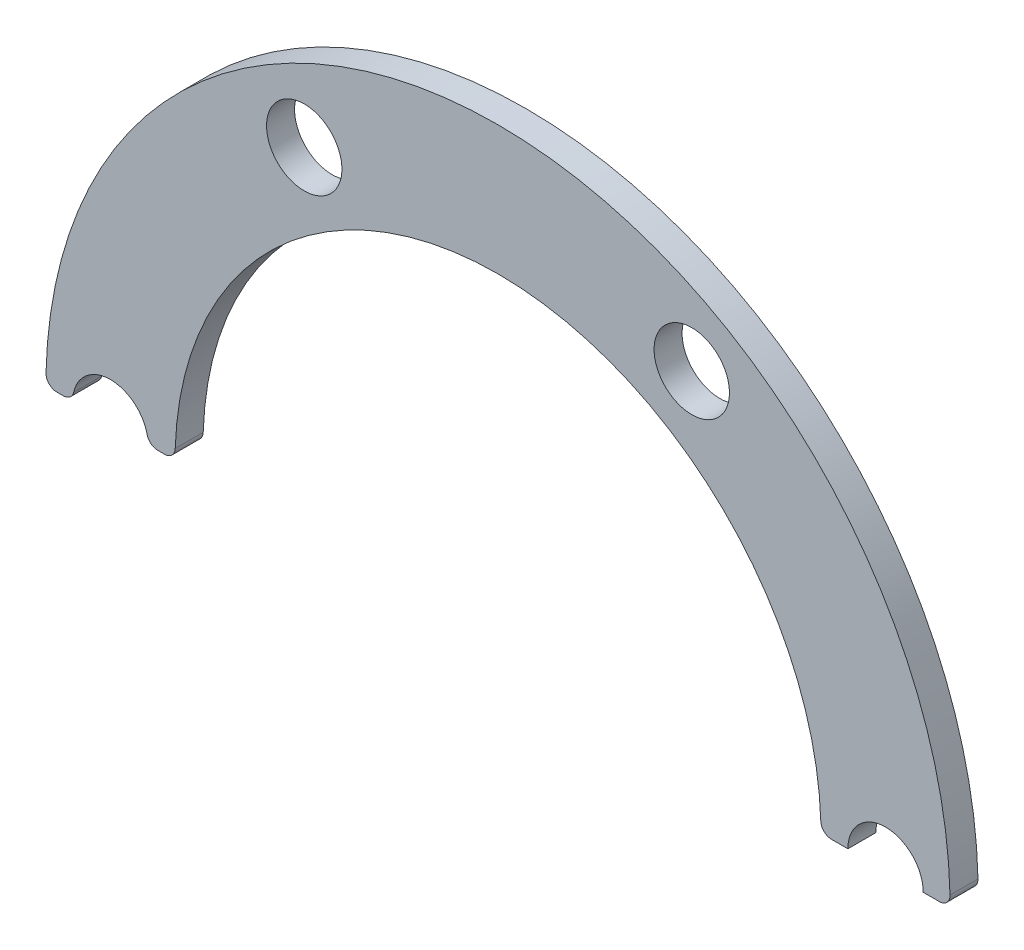
from build123d import *

# Parameters (mm, degrees)
SALIENTE_EXTRUIR1_DEPTH = 3.302
CROQUIS2_R              = 4.445
CORTAR_EXTRUIR1_DEPTH   = 3.302
MATRIZC1_COUNT          = 4
MATRIZC1_ANGLE          = 180
REDONDEO1_R             = 1.27


with BuildPart() as part:
    # Croquis1 → Saliente-Extruir1 (new body)
    with BuildSketch(Plane.XY):
        with BuildLine():
            Line((-38.1, 0), (-53.34, 0))
            ThreePointArc((-53.34, 0), (0, 53.34), (53.34, 0))
            Line((53.34, 0), (38.1, 0))
            ThreePointArc((38.1, 0), (0, 38.1), (-38.1, 0))
        make_face()
    extrude(amount=SALIENTE_EXTRUIR1_DEPTH)

    # Croquis2 → Cortar-Extruir1 (cut)
    with BuildSketch(Plane.XY.offset(3.302)):
        with Locations((-45.72, 0)):
            Circle(CROQUIS2_R)
    cortar_extruir1 = extrude(amount=-CORTAR_EXTRUIR1_DEPTH, mode=Mode.SUBTRACT)

    # MatrizC1: Cortar-Extruir1 ×4 about axis
    matrizc1_axis = Axis((0, 0, 3.302), (0, 0, -1))
    for i in range(1, MATRIZC1_COUNT):
        add(cortar_extruir1.rotate(matrizc1_axis, i * MATRIZC1_ANGLE / (MATRIZC1_COUNT - 1)), mode=Mode.SUBTRACT)

    # Redondeo1
    redondeo1_edges = [part.edges().sort_by_distance(p)[0] for p in [
        (53.34, 0, 1.651),
        (38.1, 0, 1.651),
        (-41.275, 0, 1.651),
        (-50.165, 0, 1.651),
        (-38.1, 0, 1.651),
        (-53.34, 0, 1.651),
    ]]
    fillet(redondeo1_edges, radius=REDONDEO1_R)


solid = part.part
